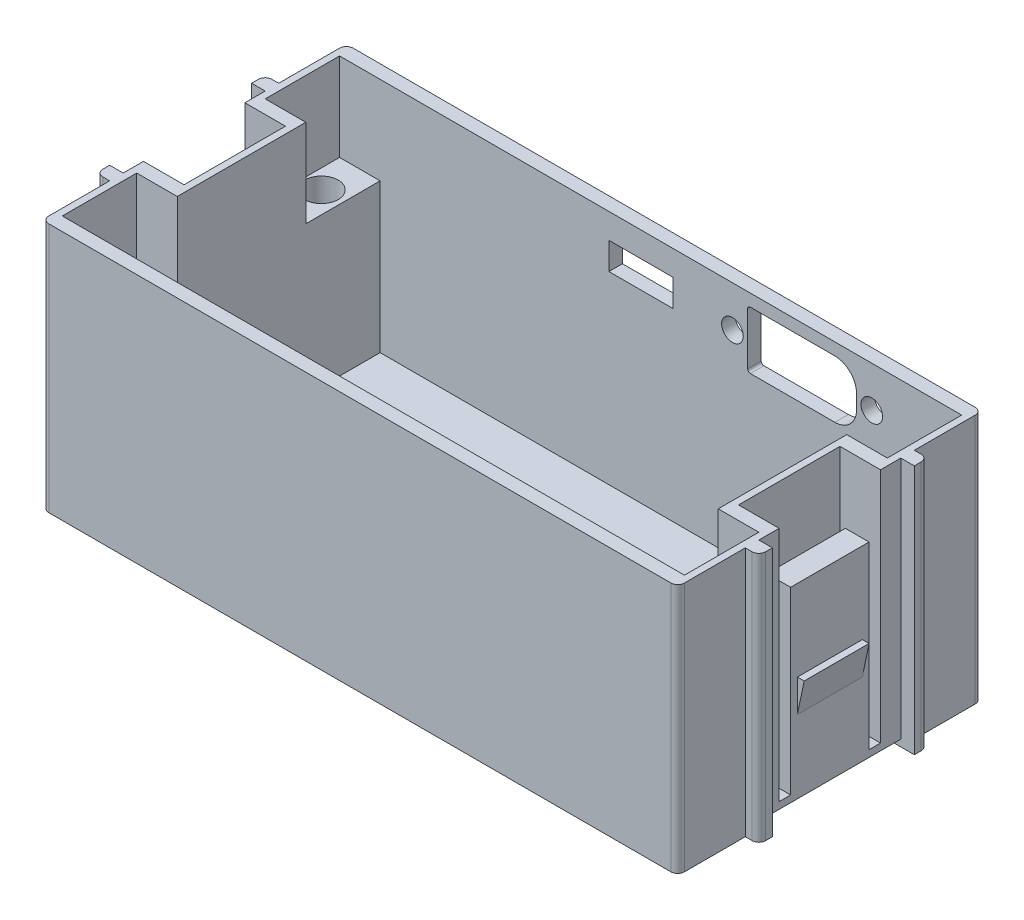
from build123d import *

# Parameters (mm, degrees)
SKETCH1_W            = 47
SKETCH1_H            = 45
BOSS_EXTRUDE1_DEPTH  = 2
BOSS_EXTRUDE3_DEPTH  = 35
BOSS_EXTRUDE4_DEPTH  = 4.8
SKETCH6_W            = 2
SKETCH6_H            = 2
BOSS_EXTRUDE5_DEPTH  = 37
SKETCH13_W           = 6
SKETCH13_H           = 11
BOSS_EXTRUDE7_DEPTH  = 22
SKETCH23_W           = 3.5
SKETCH23_H           = 26.6
BOSS_EXTRUDE9_DEPTH  = 1
SKETCH24_W           = 3.5
SKETCH24_H           = 26.6
BOSS_EXTRUDE10_DEPTH = 1
HOLE2_D              = 3.2
HOLE2_DEPTH          = 15
HOLE2_CBORE_D        = 5
HOLE2_CBORE_DEPTH    = 5
FILLET1_R            = 1
FILLET2_R            = 1
SKETCH25_W           = 1
SKETCH25_H           = 15
CUT_EXTRUDE5_DEPTH   = 35
FILLET1_OF_MIRROR1_R = 1
FILLET2_OF_MIRROR1_R = 1
CHAMFER1_SIZE        = 1
SKETCH19_R           = 1.6
CUT_EXTRUDE1_DEPTH   = 10
SKETCH20_W           = 9.5
SKETCH20_H           = 4
CUT_EXTRUDE2_DEPTH   = 10


with BuildPart() as part:
    # Sketch1 → Boss-Extrude1 (new body)
    with BuildSketch(Plane(origin=(0, 0, 0), x_dir=(1, 0, 0), z_dir=(0, 1, 0))):
        with Locations((-23.5, 22.5)):
            Rectangle(SKETCH1_W, SKETCH1_H)
    boss_extrude1 = extrude(amount=BOSS_EXTRUDE1_DEPTH)

    # Sketch4 → Boss-Extrude3 (add)
    with BuildSketch(Plane(origin=(0, 2, 0), x_dir=(1, 0, 0), z_dir=(0, 1, 0))):
        Polygon((-42, 15), (-47, 15), (-47, 0), (0, 0), (0, 2), (-0.864229009, 2), (-2, 2), (-45, 2), (-46, 2), (-46, 13), (-45, 13), (-40, 13), (-40, 32), (-45, 32), (-46, 32), (-46, 43), (-45, 43), (-2, 43), (0, 43), (0, 45), (-47, 45), (-47, 30), (-42, 30), align=None)
    boss_extrude3 = extrude(amount=BOSS_EXTRUDE3_DEPTH)

    # Sketch5 → Boss-Extrude4 (add, symmetric)
    with BuildSketch(Plane.XY.offset(-22.5)):
        Polygon((-47, 2), (-47, 11.8), (-48, 16.6), (-47, 16.6), (-47, 28.6), (-43.5, 28.6), (-43.5, 2), align=None)
    boss_extrude4 = extrude(amount=BOSS_EXTRUDE4_DEPTH, both=True)

    # Sketch6 → Boss-Extrude5 (add)
    with BuildSketch(Plane(origin=(0, 0, 0), x_dir=(-1, 0, 0), z_dir=(0, -1, 0))):
        with Locations((48, 34)):
            Rectangle(SKETCH6_W, SKETCH6_H)
        with Locations((48, 11)):
            Rectangle(SKETCH6_W, SKETCH6_H)
    boss_extrude5 = extrude(amount=-BOSS_EXTRUDE5_DEPTH)

    # Sketch13 → Boss-Extrude7 (add)
    with BuildSketch(Plane(origin=(0, 2, 0), x_dir=(1, 0, 0), z_dir=(0, 1, 0))):
        with Locations((-43, 37.5)):
            Rectangle(SKETCH13_W, SKETCH13_H)
        with Locations((-43, 7.5)):
            Rectangle(SKETCH13_W, SKETCH13_H)
    boss_extrude7 = extrude(amount=BOSS_EXTRUDE7_DEPTH)

    # Sketch23 → Boss-Extrude9 (add)
    with BuildSketch(Plane.XY.offset(-17.7)):
        with Locations((-45.25, 15.3)):
            Rectangle(SKETCH23_W, SKETCH23_H)
    boss_extrude9 = extrude(amount=BOSS_EXTRUDE9_DEPTH)

    # Sketch24 → Boss-Extrude10 (add)
    with BuildSketch(Plane(origin=(0, 0, -27.3), x_dir=(-1, 0, 0), z_dir=(0, 0, -1))):
        with Locations((45.25, 15.3)):
            Rectangle(SKETCH24_W, SKETCH24_H)
    boss_extrude10 = extrude(amount=BOSS_EXTRUDE10_DEPTH)

    # Hole2
    with Locations(Plane(origin=(-43.2, 24, -7.5), x_dir=(0, 0, 1), z_dir=(0, 1, 0))):
        with Locations((0, 0), (-30, 0)):
            hole2 = CounterBoreHole(HOLE2_D / 2, HOLE2_CBORE_D / 2, HOLE2_CBORE_DEPTH, depth=HOLE2_DEPTH)

    # Fillet1
    fillet1_edges = [part.edges().sort_by_distance(p)[0] for p in [
        (-47, 18.5, 0),
        (-47, 18.5, -45),
        (-49, 18.5, -35),
        (-49, 18.5, -10),
    ]]
    fillet(fillet1_edges, radius=FILLET1_R)

    # Fillet2
    fillet2_edges = [part.edges().sort_by_distance(p)[0] for p in [
        (-43.5, 2, -22.5),
    ]]
    fillet(fillet2_edges, radius=FILLET2_R)

    # Sketch25 → Cut-Extrude5 (cut)
    with BuildSketch(Plane(origin=(0, 37, 0), x_dir=(1, 0, 0), z_dir=(0, 1, 0))):
        with Locations((-41.5, 22.5)):
            Rectangle(SKETCH25_W, SKETCH25_H)
    cut_extrude5 = extrude(amount=-CUT_EXTRUDE5_DEPTH, mode=Mode.SUBTRACT)

    # Mirror1: Boss-Extrude1, Boss-Extrude3, Boss-Extrude4, Boss-Extrude5, Boss-Extrude7, Boss-Extrude9, Boss-Extrude10, Hole2, Cut-Extrude5 across plane
    add(boss_extrude1.mirror(Plane(origin=(0, 0, 0), x_dir=(0, 0, 1), z_dir=(1, 0, 0))))
    add(boss_extrude3.mirror(Plane(origin=(0, 0, 0), x_dir=(0, 0, 1), z_dir=(1, 0, 0))))
    add(boss_extrude4.mirror(Plane(origin=(0, 0, 0), x_dir=(0, 0, 1), z_dir=(1, 0, 0))))
    add(boss_extrude5.mirror(Plane(origin=(0, 0, 0), x_dir=(0, 0, 1), z_dir=(1, 0, 0))))
    add(boss_extrude7.mirror(Plane(origin=(0, 0, 0), x_dir=(0, 0, 1), z_dir=(1, 0, 0))))
    add(boss_extrude9.mirror(Plane(origin=(0, 0, 0), x_dir=(0, 0, 1), z_dir=(1, 0, 0))))
    add(boss_extrude10.mirror(Plane(origin=(0, 0, 0), x_dir=(0, 0, 1), z_dir=(1, 0, 0))))
    add(hole2.mirror(Plane(origin=(0, 0, 0), x_dir=(0, 0, 1), z_dir=(1, 0, 0))), mode=Mode.SUBTRACT)
    add(cut_extrude5.mirror(Plane(origin=(0, 0, 0), x_dir=(0, 0, 1), z_dir=(1, 0, 0))), mode=Mode.SUBTRACT)

    # Fillet1 of Mirror1
    fillet1_of_mirror1_edges = [part.edges().sort_by_distance(p)[0] for p in [
        (47, 18.5, 0),
        (47, 18.5, -45),
        (49, 18.5, -35),
        (49, 18.5, -10),
    ]]
    fillet(fillet1_of_mirror1_edges, radius=FILLET1_OF_MIRROR1_R)

    # Fillet2 of Mirror1
    fillet2_of_mirror1_edges = [part.edges().sort_by_distance(p)[0] for p in [
        (43.5, 2, -22.5),
    ]]
    fillet(fillet2_of_mirror1_edges, radius=FILLET2_OF_MIRROR1_R)

    # Chamfer1
    chamfer1_edges = [part.edges().sort_by_distance(p)[0] for p in [
        (47, 0, -22.5),
        (-47, 0, -22.5),
    ]]
    chamfer(chamfer1_edges, length=CHAMFER1_SIZE)

    # Sketch19 → Cut-Extrude1 (cut)
    with BuildSketch(Plane(origin=(-58.916405474, -6.932652766, -45), x_dir=(-1, 0, 0), z_dir=(0, 0, -1))):
        with Locations((-91.616405474, 37.882652766)):
            Circle(SKETCH19_R)
        with Locations((-71.016405474, 37.882652766)):
            Circle(SKETCH19_R)
        with BuildLine():
            Line((-73.666405474, 42.132652766), (-86.166405474, 42.132652766))
            ThreePointArc((-86.166405474, 42.132652766), (-88.429147174, 41.195394466), (-89.366405474, 38.932652766))
            Line((-89.366405474, 38.932652766), (-89.366405474, 36.832652766))
            ThreePointArc((-89.366405474, 36.832652766), (-88.429147174, 34.569911067), (-86.166405474, 33.632652766))
            Line((-86.166405474, 33.632652766), (-73.666405474, 33.632652766))
            ThreePointArc((-73.666405474, 33.632652766), (-73.383562762, 33.749810054), (-73.266405474, 34.032652766))
            Line((-73.266405474, 34.032652766), (-73.266405474, 41.732652766))
            ThreePointArc((-73.266405474, 41.732652766), (-73.383562762, 42.015495479), (-73.666405474, 42.132652766))
        make_face()
    extrude(amount=-CUT_EXTRUDE1_DEPTH, mode=Mode.SUBTRACT)

    # Sketch20 → Cut-Extrude2 (cut)
    with BuildSketch(Plane(origin=(-58.916405474, -6.932652766, -45), x_dir=(-1, 0, 0), z_dir=(0, 0, -1))):
        with Locations((-57.496405474, 38.232652766)):
            Rectangle(SKETCH20_W, SKETCH20_H)
    extrude(amount=-CUT_EXTRUDE2_DEPTH, mode=Mode.SUBTRACT)


solid = part.part
